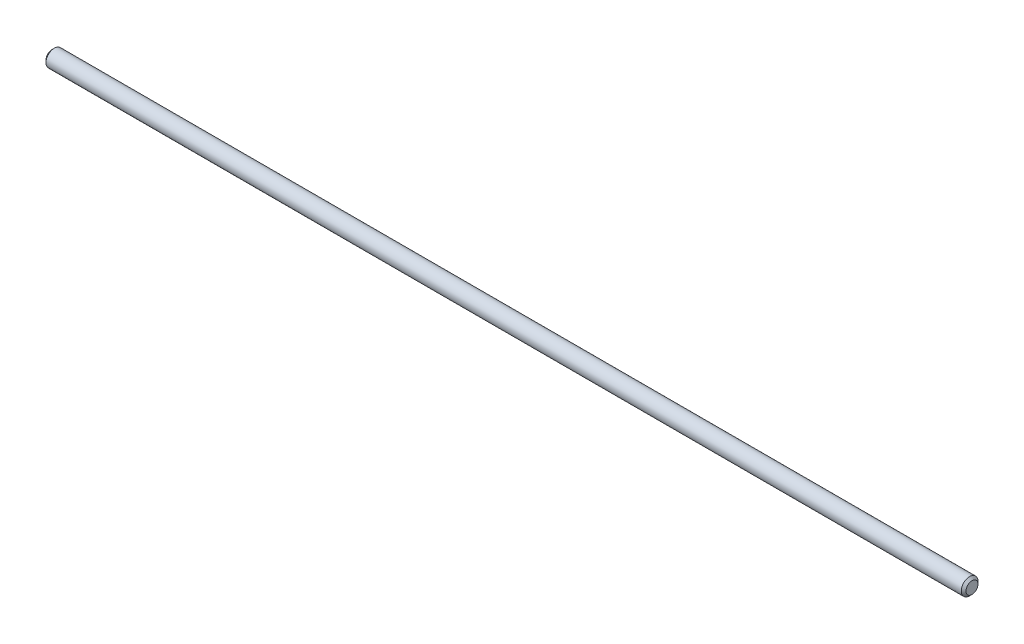
from build123d import *

# Parameters (mm, degrees)
BOSS_EXTRUDE1_DEPTH      = 114.3
BOSS_EXTRUDE1_DEPTH_BACK = 114.3
SKETCH2_R                = 2.0828
CHAMFER1_SIZE            = 0.5953125


with BuildPart() as part:
    # Sketch2 → Boss-Extrude1 (new, two sides: drawn at the far end of the back side and taken through both)
    with BuildSketch(Plane(origin=(0, 0, 0), x_dir=(0, 0, -1), z_dir=(1, 0, 0)).offset(-BOSS_EXTRUDE1_DEPTH_BACK)):
        Circle(SKETCH2_R)
    extrude(amount=BOSS_EXTRUDE1_DEPTH + BOSS_EXTRUDE1_DEPTH_BACK)

    # Chamfer1
    chamfer1_edges = [part.edges().sort_by_distance(p)[0] for p in [
        (-114.3, 0, 2.0828),
        (114.3, 0, 2.0828),
    ]]
    chamfer(chamfer1_edges, length=CHAMFER1_SIZE)


solid = part.part
